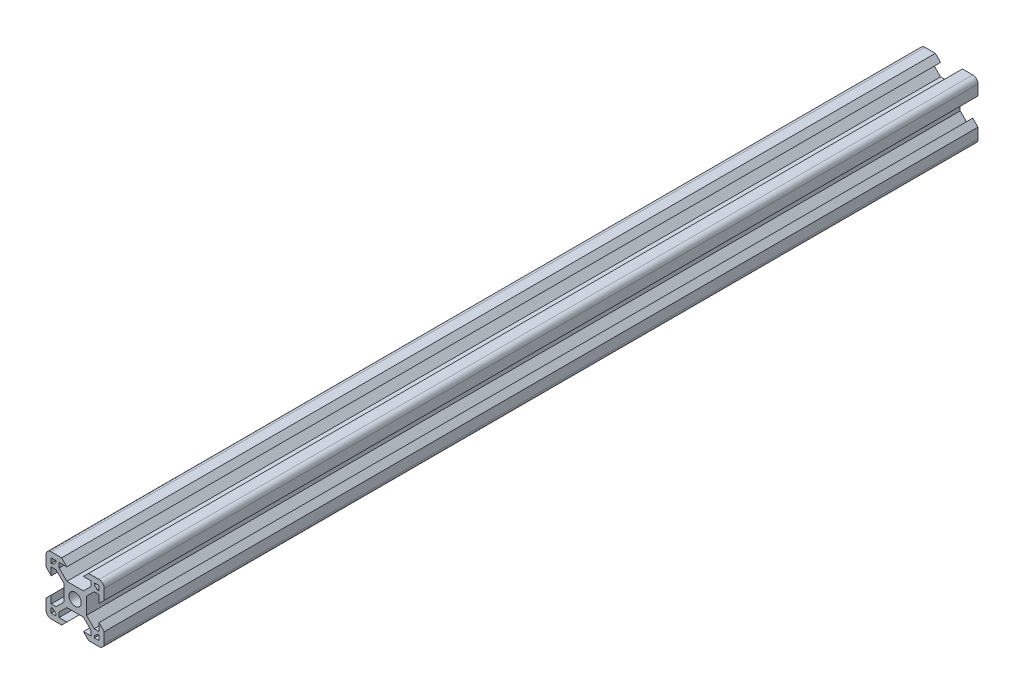
from build123d import *

# Parameters (mm, degrees)
ESQUISSE1_R        = 2.1
BOSS_EXTRU_2_DEPTH = 150


with BuildPart() as part:
    # Esquisse1 → Boss.-Extru.2 (new, symmetric)
    with BuildSketch(Plane.XY):
        with BuildLine():
            Line((-3.900660172, 0), (-3.900660172, -2.84))
            Line((-3.900660172, -2.84), (-6.56, -5.499339828))
            Line((-6.56, -5.499339828), (-8.2, -5.499339828))
            Line((-8.2, -5.499339828), (-8.2, -2.84))
            Line((-8.2, -2.84), (-10, -4.64))
            Line((-10, -4.64), (-10, -8.2))
            ThreePointArc((-10, -8.2), (-9.472792206, -9.472792206), (-8.2, -10))
            Line((-8.2, -10), (-4.64, -10))
            Line((-4.64, -10), (-2.84, -8.2))
            Line((-2.84, -8.2), (-5.499339828, -8.2))
            Line((-5.499339828, -8.2), (-5.499339828, -6.56))
            Line((-5.499339828, -6.56), (-2.84, -3.900660172))
            Line((-2.84, -3.900660172), (0, -3.900660172))
            Line((0, -3.900660172), (2.84, -3.900660172))
            Line((2.84, -3.900660172), (5.499339828, -6.56))
            Line((5.499339828, -6.56), (5.499339828, -8.2))
            Line((5.499339828, -8.2), (2.84, -8.2))
            Line((2.84, -8.2), (4.64, -10))
            Line((4.64, -10), (8.2, -10))
            ThreePointArc((8.2, -10), (9.472792206, -9.472792206), (10, -8.2))
            Line((10, -8.2), (10, -4.64))
            Line((10, -4.64), (8.2, -2.84))
            Line((8.2, -2.84), (8.2, -5.499339828))
            Line((8.2, -5.499339828), (6.56, -5.499339828))
            Line((6.56, -5.499339828), (3.900660172, -2.84))
            Line((3.900660172, -2.84), (3.900660172, 0))
            Line((3.900660172, 0), (3.900660172, 2.84))
            Line((3.900660172, 2.84), (6.56, 5.499339828))
            Line((6.56, 5.499339828), (8.2, 5.499339828))
            Line((8.2, 5.499339828), (8.2, 2.84))
            Line((8.2, 2.84), (10, 4.64))
            Line((10, 4.64), (10, 8.2))
            ThreePointArc((10, 8.2), (9.472792206, 9.472792206), (8.2, 10))
            Line((8.2, 10), (4.64, 10))
            Line((4.64, 10), (2.84, 8.2))
            Line((2.84, 8.2), (5.499339828, 8.2))
            Line((5.499339828, 8.2), (5.499339828, 6.56))
            Line((5.499339828, 6.56), (2.84, 3.900660172))
            Line((2.84, 3.900660172), (0, 3.900660172))
            Line((0, 3.900660172), (-2.84, 3.900660172))
            Line((-2.84, 3.900660172), (-5.499339828, 6.56))
            Line((-5.499339828, 6.56), (-5.499339828, 8.2))
            Line((-5.499339828, 8.2), (-2.84, 8.2))
            Line((-2.84, 8.2), (-4.64, 10))
            Line((-4.64, 10), (-8.2, 10))
            ThreePointArc((-8.2, 10), (-9.472792206, 9.472792206), (-10, 8.2))
            Line((-10, 8.2), (-10, 4.64))
            Line((-10, 4.64), (-8.2, 2.84))
            Line((-8.2, 2.84), (-8.2, 5.499339828))
            Line((-8.2, 5.499339828), (-6.56, 5.499339828))
            Line((-6.56, 5.499339828), (-3.900660172, 2.84))
            Line((-3.900660172, 2.84), (-3.900660172, 0))
        make_face()
        Circle(ESQUISSE1_R, mode=Mode.SUBTRACT)
        Polygon((-8.2, -8.2), (-8.2, -6.569339828), (-7.63, -6.569339828), (-6.569339828, -7.63), (-6.569339828, -8.2), align=None, mode=Mode.SUBTRACT)
        Polygon((-8.2, 6.569339828), (-8.2, 8.2), (-6.569339828, 8.2), (-6.569339828, 7.63), (-7.63, 6.569339828), align=None, mode=Mode.SUBTRACT)
        Polygon((6.569339828, 8.2), (8.2, 8.2), (8.2, 6.569339828), (7.63, 6.569339828), (6.569339828, 7.63), align=None, mode=Mode.SUBTRACT)
        Polygon((8.2, -6.569339828), (8.2, -8.2), (6.569339828, -8.2), (6.569339828, -7.63), (7.63, -6.569339828), align=None, mode=Mode.SUBTRACT)
    extrude(amount=BOSS_EXTRU_2_DEPTH, both=True)


solid = part.part
